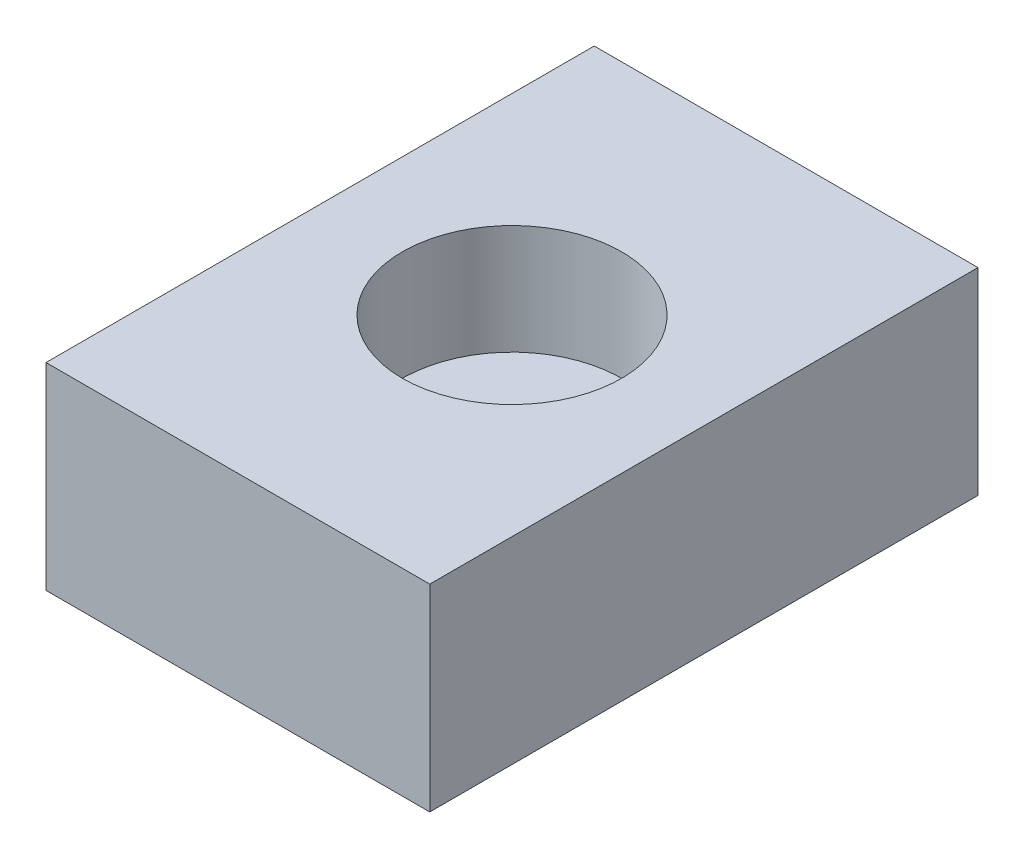
from build123d import *

# Parameters (mm, degrees)
SKETCH1_W           = 35
SKETCH1_H           = 50
BOSS_EXTRUDE1_DEPTH = 18
SKETCH3_R           = 10
CUT_EXTRUDE1_DEPTH  = 10


with BuildPart() as part:
    # Sketch1 → Boss-Extrude1 (new body)
    with BuildSketch(Plane(origin=(0, 0, 0), x_dir=(1, 0, 0), z_dir=(0, 1, 0))):
        Rectangle(SKETCH1_W, SKETCH1_H)
    extrude(amount=BOSS_EXTRUDE1_DEPTH)

    # Sketch3 → Cut-Extrude1 (cut)
    with BuildSketch(Plane(origin=(0, 18, 0), x_dir=(1, 0, 0), z_dir=(0, 1, 0))):
        with Locations(Location((0, 0, 0), (0, 0, 270))):
            Circle(SKETCH3_R)
    extrude(amount=-CUT_EXTRUDE1_DEPTH, mode=Mode.SUBTRACT)


solid = part.part
